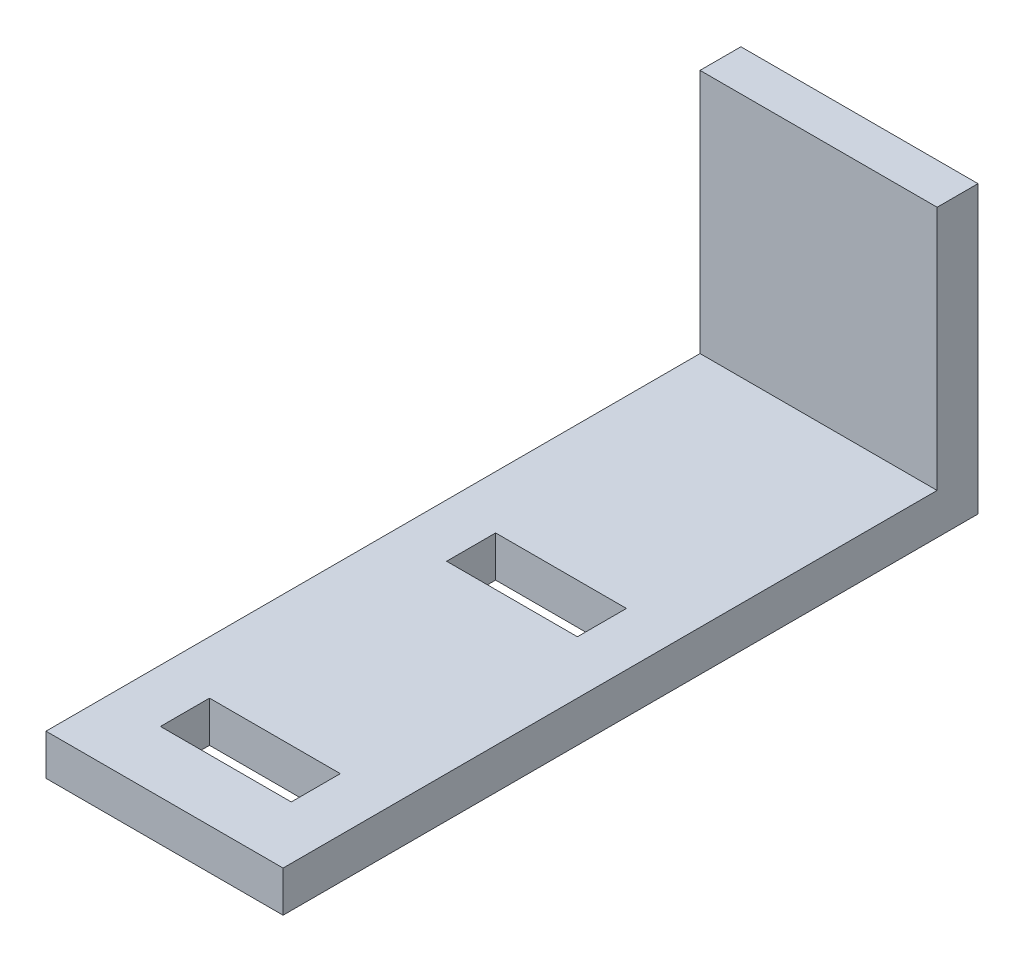
from build123d import *

# Parameters (mm, degrees)
SCHIZZO1_W                   = 29
SCHIZZO1_H                   = 35
ESTRUSIONE_ESTRUSIONE1_DEPTH = 5
SCHIZZO2_W                   = 29
SCHIZZO2_H                   = 5
ESTRUSIONE_ESTRUSIONE2_DEPTH = 80
SCHIZZO4_W                   = 16
SCHIZZO4_H                   = 6
TAGLIO_ESTRUSIONE2_DEPTH     = 10


with BuildPart() as part:
    # Schizzo1 → Estrusione-Estrusione1 (new body)
    with BuildSketch(Plane.XY):
        Rectangle(SCHIZZO1_W, SCHIZZO1_H)
    extrude(amount=ESTRUSIONE_ESTRUSIONE1_DEPTH)

    # Schizzo2 → Estrusione-Estrusione2 (add)
    with BuildSketch(Plane.XY.offset(5)):
        with Locations((0, -15)):
            Rectangle(SCHIZZO2_W, SCHIZZO2_H)
    extrude(amount=ESTRUSIONE_ESTRUSIONE2_DEPTH)

    # Schizzo4 → Taglio-Estrusione2 (cut)
    with BuildSketch(Plane(origin=(0, -12.5, 0), x_dir=(1, 0, 0), z_dir=(0, 1, 0))):
        with Locations((0, -39.5)):
            Rectangle(SCHIZZO4_W, SCHIZZO4_H)
        with Locations((0, -74.5)):
            Rectangle(SCHIZZO4_W, SCHIZZO4_H)
    extrude(amount=-TAGLIO_ESTRUSIONE2_DEPTH, mode=Mode.SUBTRACT)


solid = part.part
